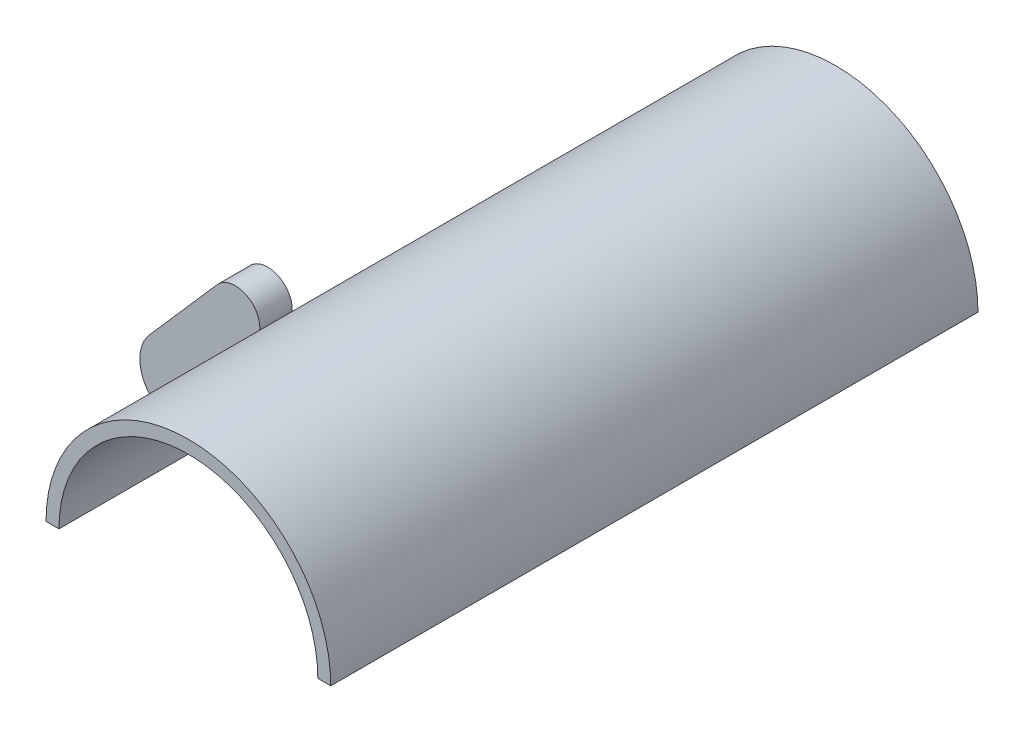
from build123d import *

# Parameters (mm, degrees)
EXTRUDE_1_DEPTH     = 50
EXTRUDE_3_DEPTH     = 5
EXTRUDE_4_DEPTH     = 1
CUT_EXTRUDE_START   = -27
CUT_EXTRUDE_2_DEPTH = 27
RIB_1_REACH         = 82.675
SKETCH_8_WALL_W     = 167.172938794
SKETCH_8_WALL_H     = 5


with BuildPart() as part:
    # 草图1 → 凸台-拉伸1 (new, symmetric)
    with BuildSketch(Plane.XY):
        with BuildLine():
            Line((-22, 0), (-20, 0))
            ThreePointArc((-20, 0), (0, 20), (20, 0))
            Line((20, 0), (22, 0))
            ThreePointArc((22, 0), (0, 22), (-22, 0))
        make_face()
    extrude(amount=EXTRUDE_1_DEPTH, both=True)

    # 草图2 → 凸台-拉伸3 (add)
    with BuildSketch(Plane.XY.offset(21)):
        with BuildLine():
            Line((-24.585593375, 15.877042923), (-35.01647279, 3.949870066))
            ThreePointArc((-35.01647279, 3.949870066), (-33.703063099, -5.073498476), (-24.991803279, -2.379026877))
            Line((-24.991803279, -2.379026877), (-20.196721311, 8.723098547))
            ThreePointArc((-20.196721311, 8.723098547), (-19.222070856, 10.701027615), (-18.054320126, 12.571456749))
            ThreePointArc((-18.054320126, 12.571456749), (-20.036220369, 16.760693495), (-24.585593375, 15.877042923))
        make_face()
        with BuildLine():
            Line((-33.627552512, 2.493675056), (-23.696783161, 14.948787263))
            ThreePointArc((-23.696783161, 14.948787263), (-20.37363516, 15.482465408), (-19.530762331, 12.223985641))
            Line((-19.530762331, 12.223985641), (-26.961919184, -1.866007539))
            ThreePointArc((-26.961919184, -1.866007539), (-32.68948429, -3.347560088), (-33.627552512, 2.493675056))
        make_face(mode=Mode.SUBTRACT)
    extrude(amount=-EXTRUDE_3_DEPTH)

    # 草图3 → 凸台-拉伸4 (add)
    with BuildSketch(Plane.XY.offset(21)):
        with BuildLine():
            Line((-23.696783161, 14.948787263), (-33.627552512, 2.493675056))
            ThreePointArc((-33.627552512, 2.493675056), (-32.68948429, -3.347560088), (-26.961919184, -1.866007539))
            Line((-26.961919184, -1.866007539), (-19.530762331, 12.223985641))
            ThreePointArc((-19.530762331, 12.223985641), (-20.37363516, 15.482465408), (-23.696783161, 14.948787263))
        make_face()
    extrude(amount=-EXTRUDE_4_DEPTH)

    # 草图6 → 切除-拉伸2 (cut)
    with BuildSketch(Plane(origin=(0, 0, -18), x_dir=(-1, 0, 0), z_dir=(0, 0, -1)).offset(CUT_EXTRUDE_START)):
        with BuildLine():
            Line((20, 0), (22, 0))
            ThreePointArc((22, 0), (21.478512157, 4.761671507), (19.938771315, 9.297601758))
            Line((19.938771315, 9.297601758), (18.126155741, 8.452365235))
            ThreePointArc((18.126155741, 8.452365235), (19.525920142, 4.328792279), (20, 0))
        make_face()
    extrude(amount=CUT_EXTRUDE_2_DEPTH, mode=Mode.SUBTRACT)

    # 草图8 wall → 筋1 (add, up to next)
    with BuildSketch(Plane(origin=(-23.495901639, -1.189513438, 18.5), x_dir=(0.782705129214, 0.622392706177, 0), z_dir=(-0.622392706177, 0.782705129214, 0)), mode=Mode.PRIVATE) as rib_1_sk1:
        Rectangle(SKETCH_8_WALL_W, SKETCH_8_WALL_H)
    rib_1_tool1 = extrude(rib_1_sk1.sketch, amount=RIB_1_REACH, mode=Mode.PRIVATE) - part.part
    add(rib_1_tool1.solids().sort_by_distance((-23.495901639, -1.189513438, 18.5))[0])


solid = part.part
